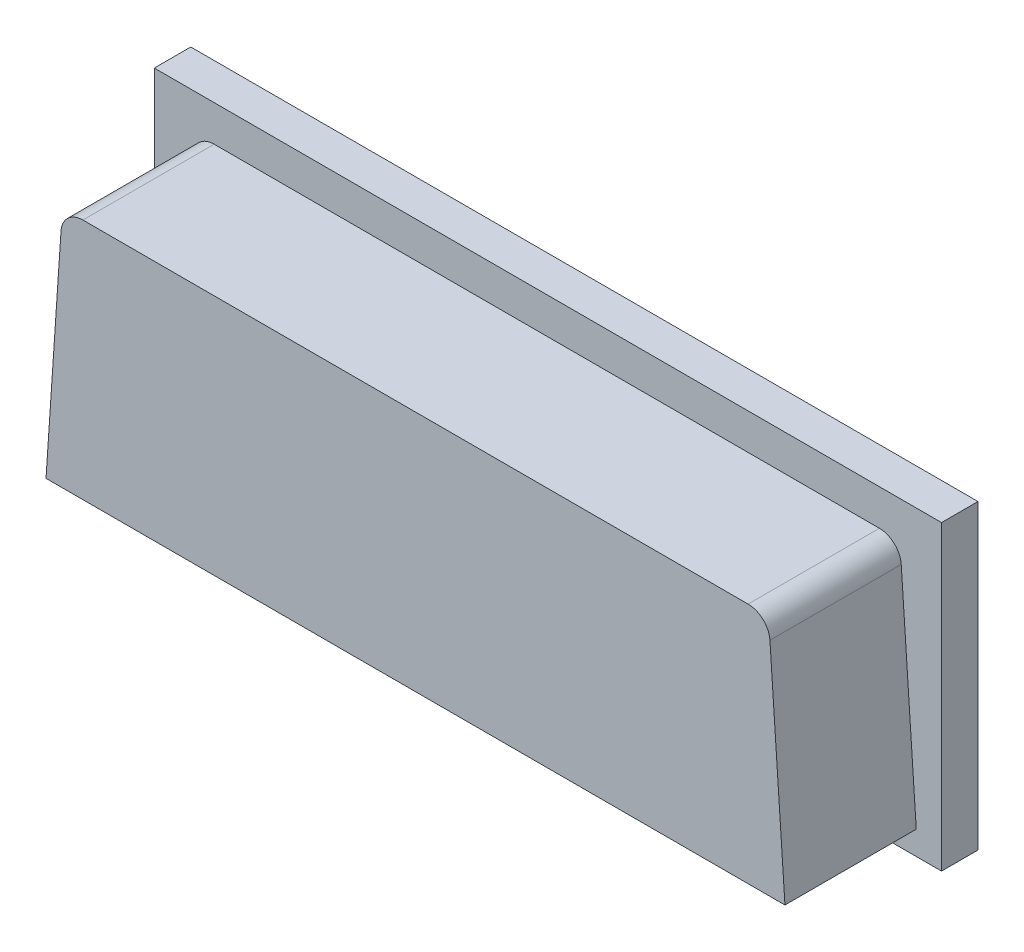
from build123d import *

# Parameters (mm, degrees)
P_IDAT_VYSUNUT_M1_DEPTH = 18
ZAOBLIT1_R              = 3
SKICA2_W                = 107.918638888
SKICA2_H                = 41.380791124
P_IDAT_VYSUNUT_M2_DEPTH = 5


with BuildPart() as part:
    # Skica1 → Přidat vysunutím1 (new body)
    with BuildSketch(Plane.XY):
        Polygon((0, 0), (101.3, 0), (99.05, 33.2), (2.25, 33.2), align=None)
    extrude(amount=P_IDAT_VYSUNUT_M1_DEPTH)

    # Zaoblit1
    zaoblit1_edges = [part.edges().sort_by_distance(p)[0] for p in [
        (2.25, 33.2, 9),
        (99.05, 33.2, 9),
    ]]
    fillet(zaoblit1_edges, radius=ZAOBLIT1_R)

    # Skica2 → Přidat vysunutím2 (add)
    with BuildSketch(Plane(origin=(0, 0, 0), x_dir=(-1, 0, 0), z_dir=(0, 0, -1))):
        with Locations((-50.804022796, 17.445366235)):
            Rectangle(SKICA2_W, SKICA2_H)
    extrude(amount=P_IDAT_VYSUNUT_M2_DEPTH)


solid = part.part
